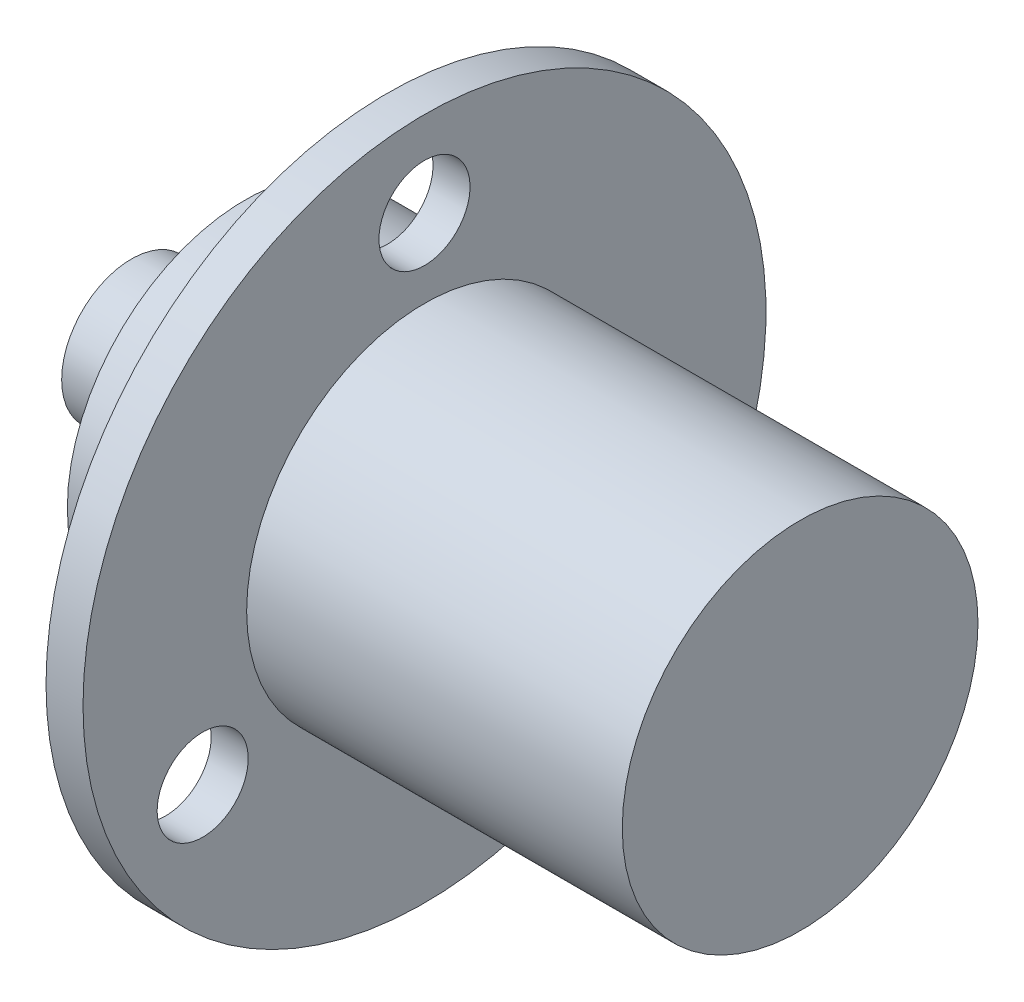
from build123d import *

# Parameters (mm, degrees)
SKETCH_2_R          = 1.6
CUT_EXTRUDE_1_DEPTH = 10


with BuildPart() as part:
    # 草图1 → 旋转1 (revolve)
    with BuildSketch(Plane.XY, mode=Mode.PRIVATE) as revolve_1_sk:
        Polygon((-9, 0), (-9, 2.45), (-5, 2.45), (-5, 6.25), (0, 6.25), (0, 12), (1.3, 12), (1.3, 6.25), (14.5, 6.25), (14.5, 0), align=None)
    revolve(revolve_1_sk.sketch.rotate(Axis((-8.079555556, 0, 0), (1, 0, 0)), 90), axis=Axis((-8.079555556, 0, 0), (1, 0, 0)))

    # 草图2 → 切除-拉伸1 (cut)
    with BuildSketch(Plane.ZY):
        with Locations((0, 9)):
            Circle(SKETCH_2_R)
        with Locations((7.794228634, -4.5)):
            Circle(SKETCH_2_R)
        with Locations((-7.794228634, -4.5)):
            Circle(SKETCH_2_R)
    extrude(amount=-CUT_EXTRUDE_1_DEPTH, mode=Mode.SUBTRACT)


solid = part.part
